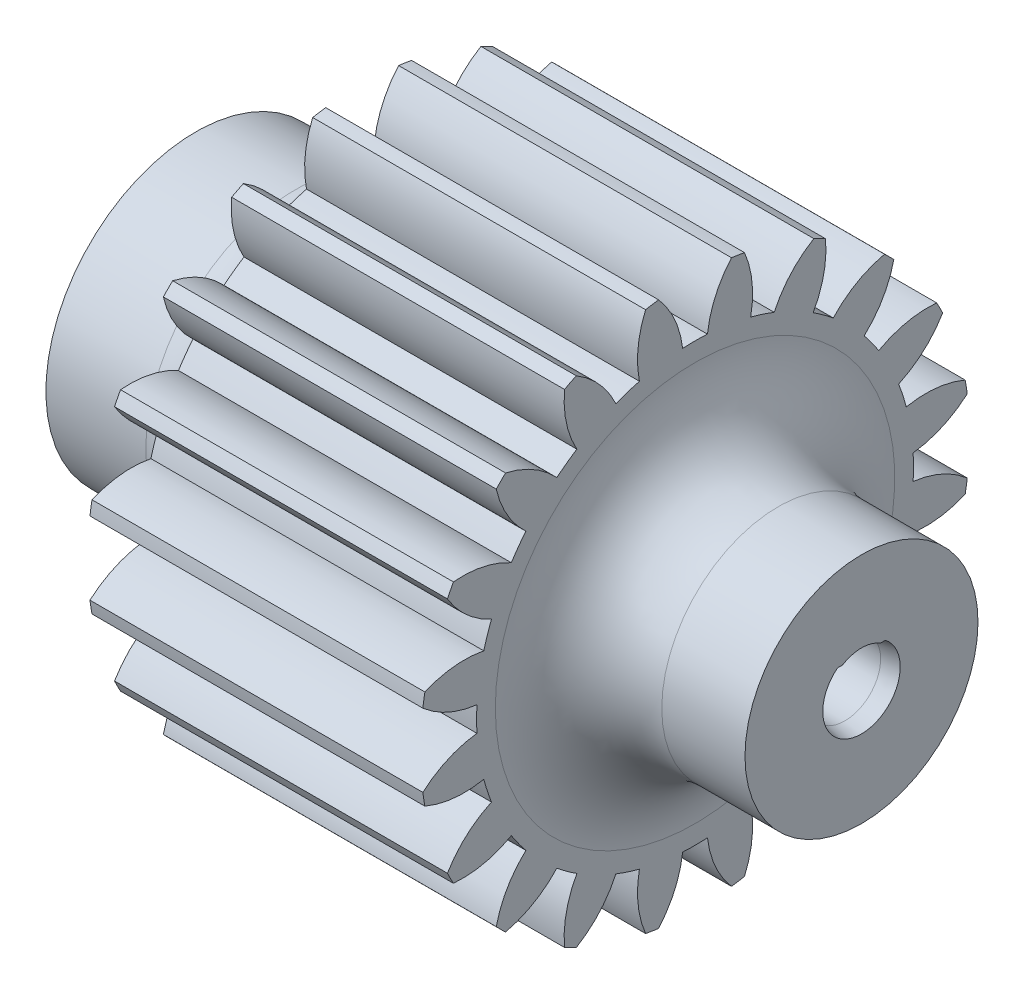
from build123d import *
from OCP.BRepFilletAPI import BRepFilletAPI_MakeChamfer
from build123d.topology import SkipClean

# Parameters (mm, degrees)
BASPROSKE_W         = 20
BASPROSKE_H         = 16.5
TOOTHCUT_DEPTH      = 31.732718721
TEETHCUTS_COUNT     = 20
TEETHCUTS_ANGLE     = 342
BORSKE_R            = 0.5
BORE_DEPTH          = 50.0000508
BOSS_EXTRUDE1_START = 10
SKETCH1_R           = 7
SKETCH1_R_2         = 0.5
BOSS_EXTRUDE1_DEPTH = 10
FILLET1_R           = 5
SKETCH2_R           = 9
BOSS_EXTRUDE2_DEPTH = 10
SKETCH3_R           = 3
BOSS_EXTRUDE3_DEPTH = 3.2
FILLET2_R           = 4
CUT_EXTRUDE1_DEPTH  = 25
CHAMFER2_SIZE       = 1
CHAMFER2_SIZE2      = 0.176326981
SKETCH5_R           = 2.15
CUT_EXTRUDE2_DEPTH  = 3


with BuildPart() as part:
    # BasProSke → Base-Revolve (revolve)
    with BuildSketch(Plane(origin=(0, 0, 0), x_dir=(1, 0, 0), z_dir=(0, 1, 0)), mode=Mode.PRIVATE) as base_revolve_sk:
        with Locations((10, 8.25)):
            Rectangle(BASPROSKE_W, BASPROSKE_H)
    revolve(base_revolve_sk.sketch.rotate(Axis((-10, 0, 0), (1, 0, 0)), 180), axis=Axis((-10, 0, 0), (1, 0, 0)))

    # TooCutSke → ToothCut (cut, through all)
    with BuildSketch(Plane(origin=(0, 0, 0), x_dir=(0, 0, -1), z_dir=(1, 0, 0))):
        with BuildLine():
            ThreePointArc((0.74381438, 13.102904875), (0, 13.124), (-0.74381438, 13.102904875))
            ThreePointArc((-0.74381438, 13.102904875), (-1.226473103, 14.852072512), (-2.209965745, 16.376962373))
            ThreePointArc((-2.209965745, 16.376962373), (0, 16.5254), (2.209965745, 16.376962373))
            ThreePointArc((2.209965745, 16.376962373), (1.226473103, 14.852072512), (0.74381438, 13.102904875))
        make_face()
    toothcut = extrude(amount=TOOTHCUT_DEPTH, mode=Mode.SUBTRACT)

    # TeethCuts: ToothCut ×20 about axis
    teethcuts_axis = Axis((-10, 0, 0), (1, 0, 0))
    for i in range(1, TEETHCUTS_COUNT):
        add(toothcut.rotate(teethcuts_axis, i * TEETHCUTS_ANGLE / (TEETHCUTS_COUNT - 1)), mode=Mode.SUBTRACT)

    # BorSke → Bore (cut, symmetric)
    with BuildSketch(Plane(origin=(0, 0, 0), x_dir=(0, 0, -1), z_dir=(1, 0, 0))):
        with Locations(Location((0, 0, 0), (0, 0, 180))):
            Circle(BORSKE_R)
    extrude(amount=BORE_DEPTH, both=True, mode=Mode.SUBTRACT)

    # Sketch1 → Boss-Extrude1 (add)
    with BuildSketch(Plane(origin=(20, 0, 0), x_dir=(0, 0, -1), z_dir=(1, 0, 0)).offset(BOSS_EXTRUDE1_START)):
        with Locations(Location((0, 0, 0), (0, 0, 180))):
            Circle(SKETCH1_R)
        Circle(SKETCH1_R_2, mode=Mode.SUBTRACT)
    extrude(amount=-BOSS_EXTRUDE1_DEPTH)

    # Fillet1
    fillet1_edges = [part.edges().sort_by_distance(p)[0] for p in [
        (20, 0, -7),
    ]]
    fillet(fillet1_edges, radius=FILLET1_R)

    # Sketch2 → Boss-Extrude2 (add)
    with BuildSketch(Plane.ZY):
        with Locations(Location((0, 0, 0), (0, 0, 180))):
            Circle(SKETCH2_R)
    extrude(amount=BOSS_EXTRUDE2_DEPTH)

    # Sketch3 → Boss-Extrude3 (add)
    with BuildSketch(Plane.ZY.offset(10)):
        with Locations(Location((0, 0, 0), (0, 0, 270))):
            Circle(SKETCH3_R)
    extrude(amount=BOSS_EXTRUDE3_DEPTH)

    # Fillet2
    fillet2_edges = [part.edges().sort_by_distance(p)[0] for p in [
        (0, 0, 9),
    ]]
    fillet(fillet2_edges, radius=FILLET2_R)

    # Sketch4 → Cut-Extrude1 (cut)
    with BuildSketch(Plane(origin=(30, 0, 0), x_dir=(0, 0, -1), z_dir=(1, 0, 0))):
        with BuildLine():
            Line((-1.378404875, 1.65), (1.378404875, 1.65))
            ThreePointArc((1.378404875, 1.65), (0, -2.15), (-1.378404875, 1.65))
        make_face()
    extrude(amount=-CUT_EXTRUDE1_DEPTH, mode=Mode.SUBTRACT)

    # Chamfer2: one chamfer whose edges measure the first distance from different faces: ONE call of the kernel's chamfer builder (chamfer() names one face for all edges)
    chamfer2_edges_1 = [part.edges().sort_by_distance(p)[0] for p in [
        (30, 1.65, 0),
    ]]
    chamfer2_side_1 = [part.faces().sort_by_distance(p)[0] for p in [
        (17.5, 1.65, 0),
    ]]
    chamfer2_edges_2 = [part.edges().sort_by_distance(p)[0] for p in [
        (30, -2.15, 0),
    ]]
    chamfer2_side_2 = [part.faces().sort_by_distance(p)[0] for p in [
        (17.5, -2.15, 0),
    ]]
    chamfer2 = BRepFilletAPI_MakeChamfer(part.part.solid().wrapped)
    for e in chamfer2_edges_1:
        chamfer2.Add(CHAMFER2_SIZE, CHAMFER2_SIZE2, e.wrapped, chamfer2_side_1[0].wrapped)  # the first distance lies on this face
    for e in chamfer2_edges_2:
        chamfer2.Add(CHAMFER2_SIZE, CHAMFER2_SIZE2, e.wrapped, chamfer2_side_2[0].wrapped)  # the first distance lies on this face
    add(Compound.cast(chamfer2.Shape()), mode=Mode.REPLACE)

    # Sketch5 → Cut-Extrude2 (cut)
    with SkipClean():  # the faces are left unmerged after this step: merging them gives an invalid solid
        with BuildSketch(Plane(origin=(30, 0, 0), x_dir=(0, 0, -1), z_dir=(1, 0, 0))):
            with Locations(Location((0, 0, 0), (0, 0, 50.124722643))):
                Circle(SKETCH5_R)
        extrude(amount=-CUT_EXTRUDE2_DEPTH, mode=Mode.SUBTRACT)


solid = part.part
